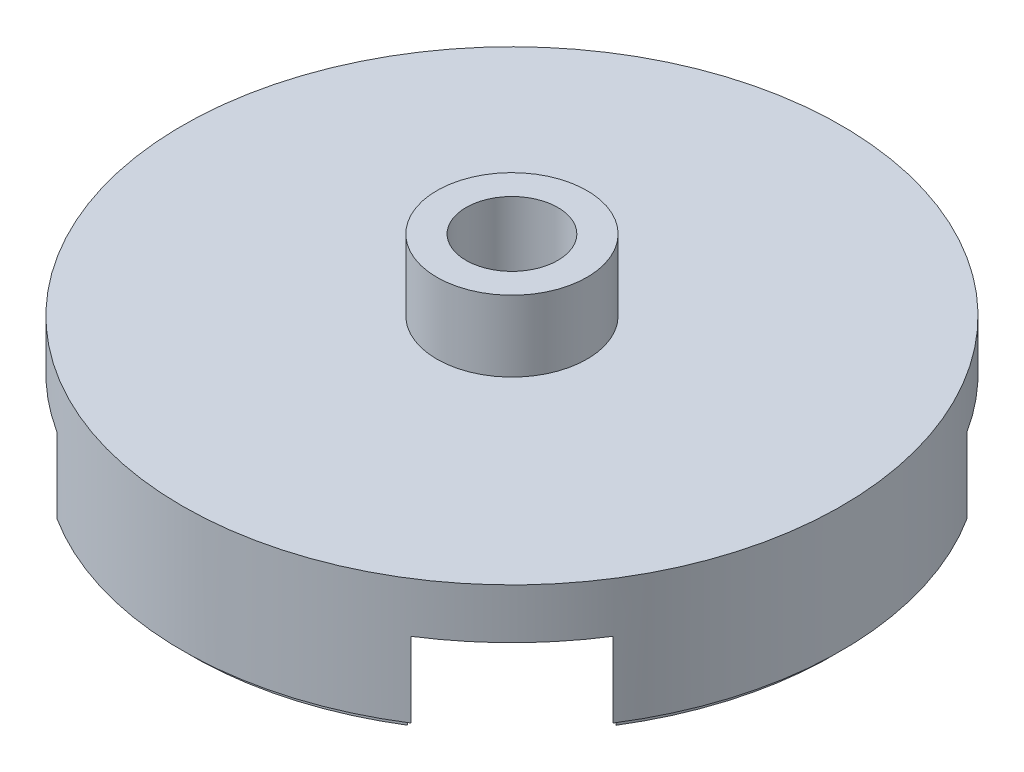
from build123d import *
from build123d.topology import SkipClean

# Parameters (mm, degrees)
SKETCH1_R               = 7.9
BOSS_EXTRUDE1_DEPTH     = 1.2
SKETCH2_R               = 1.8
BOSS_EXTRUDE2_DEPTH     = 1.7
CUT_EXTRUDE1_DEPTH      = 12.542530052
CUT_EXTRUDE1_DEPTH_BACK = 12.542530052
SKETCH3_R               = 1.1
BOSS_EXTRUDE3_START     = 2
BOSS_EXTRUDE3_DEPTH     = 2
CUT_EXTRUDE2_DEPTH      = 0.2
CIRPATTERN1_COUNT       = 4
SKETCH6_R               = 1.7
SKETCH6_R_2             = 1.1
BOSS_EXTRUDE4_DEPTH     = 2


with BuildPart() as part:
    # Sketch1 → Boss-Extrude1 (new body)
    with BuildSketch(Plane(origin=(0, 0, 0), x_dir=(1, 0, 0), z_dir=(0, 1, 0))):
        with Locations(Location((0, 0, 0), (0, 0, 270))):
            Circle(SKETCH1_R)
    extrude(amount=BOSS_EXTRUDE1_DEPTH)

    # Sketch2 → Boss-Extrude2 (add)
    with BuildSketch(Plane(origin=(0, 1.2, 0), x_dir=(1, 0, 0), z_dir=(0, 1, 0))):
        with Locations(Location((0, 0, 0), (0, 0, 270))):
            Circle(SKETCH2_R)
    extrude(amount=BOSS_EXTRUDE2_DEPTH)

    # Sketch3 → Cut-Extrude1 (cut, two sides: drawn at the far end of the back side and taken through both)
    with BuildSketch(Plane(origin=(0, 2.9, 0), x_dir=(1, 0, 0), z_dir=(0, 1, 0)).offset(-CUT_EXTRUDE1_DEPTH_BACK)):
        with Locations(Location((0, 0, 0), (0, 0, 270))):
            Circle(SKETCH3_R)
    extrude(amount=CUT_EXTRUDE1_DEPTH + CUT_EXTRUDE1_DEPTH_BACK, mode=Mode.SUBTRACT)

    # Sketch4 → Boss-Extrude3 (add)
    with SkipClean():  # the faces are left unmerged after this step: merging them gives an invalid solid
        with BuildSketch(Plane.XZ.offset(BOSS_EXTRUDE3_START)):
            with BuildLine():
                Line((4.244666906, -6.662792422), (2.951034003, -5.903507289))
                ThreePointArc((2.951034003, -5.903507289), (0, -6.6), (-2.951034003, -5.903507289))
                Line((-2.951034003, -5.903507289), (-4.244666906, -6.662792422))
                ThreePointArc((-4.244666906, -6.662792422), (0, -7.9), (4.244666906, -6.662792422))
            make_face()
        boss_extrude3 = extrude(amount=-BOSS_EXTRUDE3_DEPTH)

    # Sketch5 → Cut-Extrude2 (cut)
    with SkipClean():  # the faces are left unmerged after this step: merging them gives an invalid solid
        with BuildSketch(Plane.XZ.offset(2)):
            with BuildLine():
                Line((-4.050265696, -6.54869054), (-4.244666906, -6.662792422))
                ThreePointArc((-4.244666906, -6.662792422), (0, -7.9), (4.244666906, -6.662792422))
                Line((4.244666906, -6.662792422), (4.050265696, -6.54869054))
                ThreePointArc((4.050265696, -6.54869054), (0, -7.7), (-4.050265696, -6.54869054))
            make_face()
        cut_extrude2 = extrude(amount=-CUT_EXTRUDE2_DEPTH, mode=Mode.SUBTRACT)

    # CirPattern1: Boss-Extrude3, Cut-Extrude2 ×4 about axis
    with SkipClean():  # the faces are left unmerged after this step: merging them gives an invalid solid
        cirpattern1_axis = Axis((0, 0, 0), (0, 1, 0))
        add([boss_extrude3.rotate(cirpattern1_axis, i * 360 / CIRPATTERN1_COUNT) for i in range(1, CIRPATTERN1_COUNT)])
        add([cut_extrude2.rotate(cirpattern1_axis, i * 360 / CIRPATTERN1_COUNT) for i in range(1, CIRPATTERN1_COUNT)], mode=Mode.SUBTRACT)

    # Sketch6 → Boss-Extrude4 (add)
    with SkipClean():  # the faces are left unmerged after this step: merging them gives an invalid solid
        with BuildSketch(Plane.XZ):
            with Locations(Location((0, 0, 0), (0, 0, 90))):
                Circle(SKETCH6_R)
            with Locations(Location((0, 0, 0), (0, 0, 90))):
                Circle(SKETCH6_R_2, mode=Mode.SUBTRACT)
        extrude(amount=BOSS_EXTRUDE4_DEPTH)


solid = part.part
